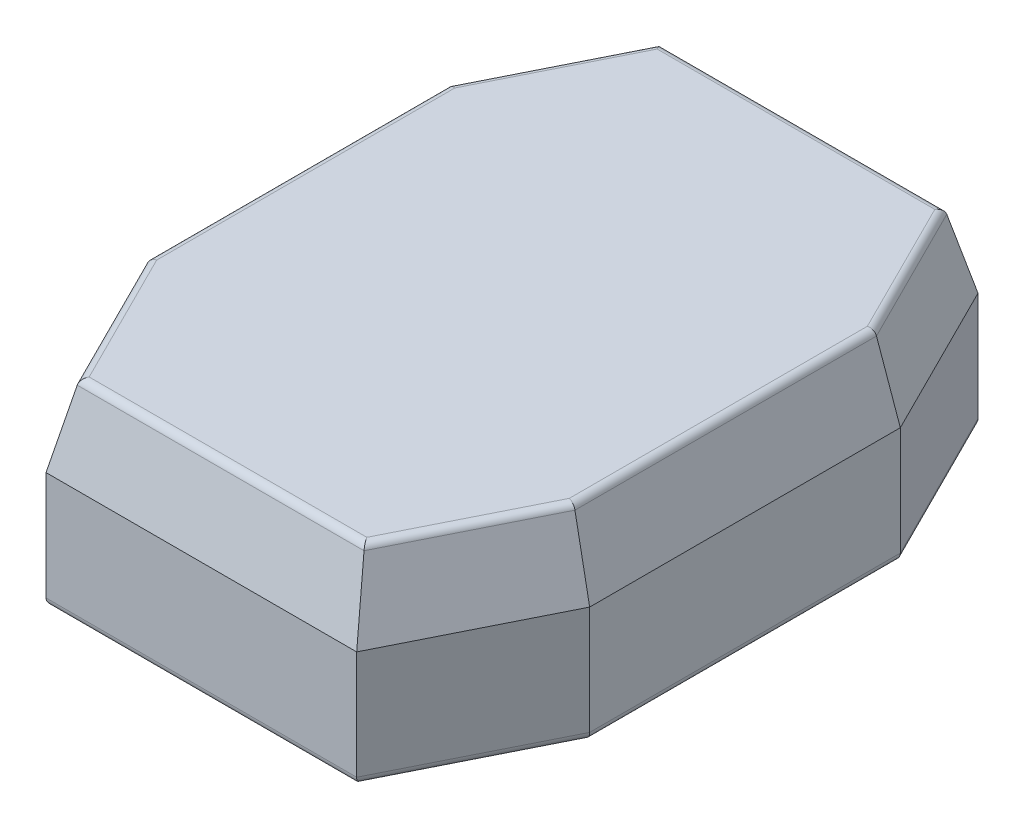
from build123d import *

# Parameters (mm, degrees)
BOSS_EXTRUDE1_DEPTH = 2.54
BOSS_EXTRUDE1_TAPER = 15
BOSS_EXTRUDE2_DEPTH = 3.8
FILLET2_R           = 0.1
CHAMFER1_SIZE       = 0.2
BOSS_EXTRUDE3_DEPTH = 3.8
FILLET3_R           = 0.25
FILLET5_R           = 0.5
FILLET6_R           = 0.1
FILLET7_R           = 0.25


with BuildPart() as part:
    # Sketch1 → Boss-Extrude1 (new body)
    with BuildSketch(Plane(origin=(0, 0, 0), x_dir=(1, 0, 0), z_dir=(0, 1, 0))):
        Polygon((-7.62, 5.08), (-7.62, -5.08), (-5.08, -10.16), (5.08, -10.16), (7.62, -5.08), (7.62, 5.08), (5.08, 10.16), (-5.08, 10.16), align=None)
    extrude(amount=BOSS_EXTRUDE1_DEPTH, taper=BOSS_EXTRUDE1_TAPER)

    # Stem → Boss-Extrude2 (add)
    with BuildSketch(Plane.XZ):
        with BuildLine():
            Line((2.499999969, 2.5), (-2.499999969, 2.5))
            ThreePointArc((-2.499999969, 2.5), (-2.85355336, 2.353553391), (-2.999999969, 2))
            Line((-2.999999969, 2), (-2.999999969, -2))
            ThreePointArc((-2.999999969, -2), (-2.85355336, -2.353553391), (-2.499999969, -2.5))
            Line((-2.499999969, -2.5), (2.499999969, -2.5))
            ThreePointArc((2.499999969, -2.5), (2.85355336, -2.353553391), (2.999999969, -2))
            Line((2.999999969, -2), (2.999999969, 2))
            ThreePointArc((2.999999969, 2), (2.85355336, 2.353553391), (2.499999969, 2.5))
        make_face()
        Polygon((-0.5625, 0.6625), (-0.5625, 2.075), (0.5625, 2.075), (0.5625, 0.6625), (2.0625, 0.6625), (2.0625, -0.6625), (0.5625, -0.6625), (0.5625, -2.075), (-0.5625, -2.075), (-0.5625, -0.6625), (-2.0625, -0.6625), (-2.0625, 0.6625), align=None, mode=Mode.SUBTRACT)
    extrude(amount=BOSS_EXTRUDE2_DEPTH)

    # Fillet2
    fillet2_edges = [part.edges().sort_by_distance(p)[0] for p in [
        (2.85355336, -3.8, 2.353553391),
        (0, -3.8, 2.5),
        (2.999999969, -3.8, 0),
        (-2.85355336, -3.8, 2.353553391),
        (-2.999999969, -3.8, 0),
        (-2.85355336, -3.8, -2.353553391),
        (0, -3.8, -2.5),
        (2.85355336, -3.8, -2.353553391),
    ]]
    fillet(fillet2_edges, radius=FILLET2_R)

    # Chamfer1
    chamfer1_edges = [part.edges().sort_by_distance(p)[0] for p in [
        (-2.0625, -3.8, 0),
        (-1.3125, -3.8, 0.6625),
        (-0.5625, -3.8, 1.36875),
        (1.3125, -3.8, 0.6625),
        (-0.5625, -3.8, -1.36875),
        (0, -3.8, 2.075),
        (0.5625, -3.8, 1.36875),
        (2.0625, -3.8, 0),
        (1.3125, -3.8, -0.6625),
        (0.5625, -3.8, -1.36875),
        (-1.3125, -3.8, -0.6625),
    ]]
    chamfer(chamfer1_edges, length=CHAMFER1_SIZE)

    # Sketch3 → Boss-Extrude3 (add)
    with BuildSketch(Plane.XZ):
        Polygon((-7.62, 5.08), (-7.62, -5.08), (-5.08, -10.16), (5.08, -10.16), (7.62, -5.08), (7.62, 5.08), (5.08, 10.16), (-5.08, 10.16), align=None)
        Polygon((-6.35, -4.780193669), (-4.295096834, -8.89), (4.295096834, -8.89), (6.35, -4.780193669), (6.35, 4.780193669), (4.295096834, 8.89), (-4.295096834, 8.89), (-6.35, 4.780193669), align=None, mode=Mode.SUBTRACT)
    extrude(amount=BOSS_EXTRUDE3_DEPTH)

    # Fillet3
    fillet3_edges = [part.edges().sort_by_distance(p)[0] for p in [
        (-6.35, -3.8, 7.62),
        (-7.62, -3.8, 0),
        (-6.35, -3.8, -7.62),
        (0, -3.8, -10.16),
        (6.35, -3.8, -7.62),
        (7.62, -3.8, 0),
        (6.35, -3.8, 7.62),
        (0, -3.8, 10.16),
        (-6.35, -3.8, 0),
        (-5.322548417, -3.8, -6.835096834),
        (0, -3.8, -8.89),
        (5.322548417, -3.8, -6.835096834),
        (6.35, -3.8, 0),
        (5.322548417, -3.8, 6.835096834),
        (0, -3.8, 8.89),
        (-5.322548417, -3.8, 6.835096834),
    ]]
    fillet(fillet3_edges, radius=FILLET3_R)

    # Fillet5
    fillet5_edges = [part.edges().sort_by_distance(p)[0] for p in [
        (-6.35, 0, 0),
        (-5.322548417, 0, -6.835096834),
        (0, 0, -8.89),
        (5.322548417, 0, -6.835096834),
        (6.35, 0, 0),
        (5.322548417, 0, 6.835096834),
        (0, 0, 8.89),
        (-5.322548417, 0, 6.835096834),
        (-2.85355336, 0, 2.353553391),
        (-2.999999969, 0, 0),
        (-2.85355336, 0, -2.353553391),
        (0, 0, -2.5),
        (2.85355336, 0, -2.353553391),
        (2.85355336, 0, 2.353553391),
        (2.999999969, 0, 0),
        (0, 0, 2.5),
    ]]
    fillet(fillet5_edges, radius=FILLET5_R)

    # Fillet6
    fillet6_edges = [part.edges().sort_by_distance(p)[0] for p in [
        (0, 0, 2.075),
        (0.5625, 0, 1.36875),
        (2.0625, 0, 0),
        (1.3125, 0, -0.6625),
        (0.5625, 0, -1.36875),
        (-1.3125, 0, -0.6625),
        (-2.0625, 0, 0),
        (-0.5625, 0, -1.36875),
        (0, 0, -2.075),
        (1.3125, 0, 0.6625),
        (-0.5625, 0, 1.36875),
        (-1.3125, 0, 0.6625),
    ]]
    fillet(fillet6_edges, radius=FILLET6_R)

    # Fillet7
    fillet7_edges = [part.edges().sort_by_distance(p)[0] for p in [
        (-6.939409051, 2.54, 0),
        (-5.799390356, 2.54, 7.199371661),
        (0, 2.54, 9.479409051),
        (5.799390356, 2.54, 7.199371661),
        (6.939409051, 2.54, 0),
        (5.799390356, 2.54, -7.199371661),
        (0, 2.54, -9.479409051),
        (-5.799390356, 2.54, -7.199371661),
    ]]
    fillet(fillet7_edges, radius=FILLET7_R)


solid = part.part
